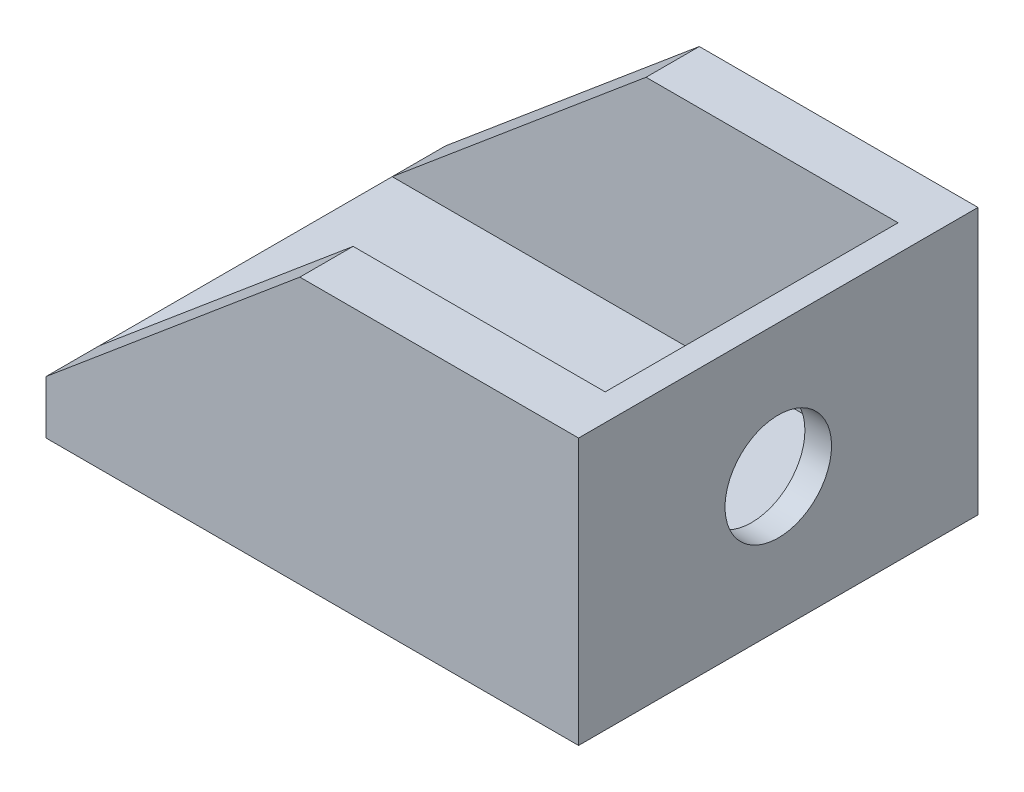
from build123d import *

# Parameters (mm, degrees)
SKETCH2_W           = 20
SKETCH2_H           = 13
BOSS_EXTRUDE1_DEPTH = 2
BOSS_EXTRUDE2_DEPTH = 2
SKETCH4_W           = 11
SKETCH4_H           = 8
BOSS_EXTRUDE3_DEPTH = 1
SKETCH5_R           = 2
CUT_EXTRUDE1_DEPTH  = 6


with BuildPart() as part:
    # Sketch2 → Boss-Extrude1 (new body)
    with BuildSketch(Plane(origin=(0, 0, 0), x_dir=(1, 0, 0), z_dir=(0, 1, 0))):
        with Locations((10, 6.5)):
            Rectangle(SKETCH2_W, SKETCH2_H)
    extrude(amount=BOSS_EXTRUDE1_DEPTH)

    # Sketch3 → Boss-Extrude2 (add)
    with BuildSketch(Plane.XY):
        Polygon((0, 0), (20, 0), (20, 10), (9.534028741, 10), (0, 2), align=None)
    boss_extrude2 = extrude(amount=BOSS_EXTRUDE2_DEPTH)

    # Mirror1: Boss-Extrude2 across plane
    add(boss_extrude2.mirror(Plane.XY.offset(-5.5)))

    # Sketch4 → Boss-Extrude3 (add)
    with BuildSketch(Plane(origin=(20, 0, 0), x_dir=(0, 0, -1), z_dir=(1, 0, 0))):
        with Locations((5.5, 6)):
            Rectangle(SKETCH4_W, SKETCH4_H)
    extrude(amount=-BOSS_EXTRUDE3_DEPTH)

    # Sketch5 → Cut-Extrude1 (cut)
    with BuildSketch(Plane(origin=(20, 0, 0), x_dir=(0, 0, -1), z_dir=(1, 0, 0))):
        with Locations((5.5, 5)):
            Circle(SKETCH5_R)
    extrude(amount=-CUT_EXTRUDE1_DEPTH, mode=Mode.SUBTRACT)


solid = part.part
